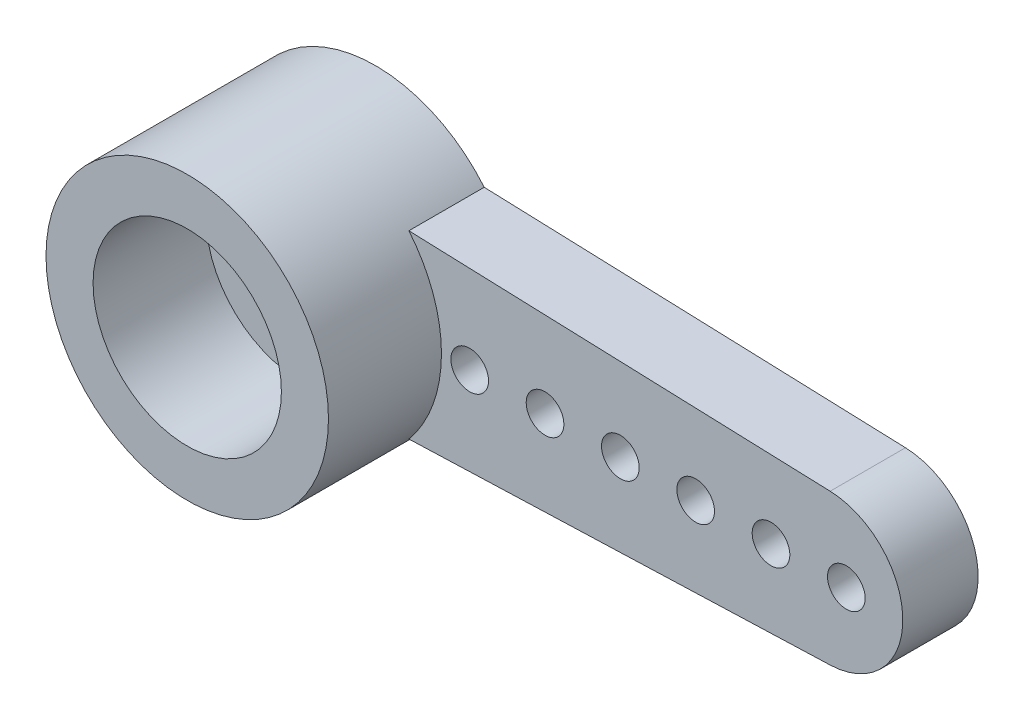
from build123d import *

# Parameters (mm, degrees)
EXTRUDE_3_DEPTH     = 2
EXTRUDE_3_2_DEPTH   = 2
SKETCH_2_R          = 3.75
SKETCH_2_R_2        = 2.5
EXTRUDE_5_DEPTH     = 3
SKETCH_4_R          = 0.5
CUT_EXTRUDE_1_DEPTH = 2
SKETCH_5_R          = 2.5
EXTRUDE_7_DEPTH     = 1
SKETCH_1_2_R        = 3.75
EXTRUDE_1_DEPTH     = 2


with BuildPart() as part:
    # Sketch 1 → Бобышка-Вытянуть3 (new body)
    with BuildSketch(Plane.XY):
        with BuildLine():
            Line((0, -2.497361401), (0.233236, -2.489096416))
            ThreePointArc((0.233236, -2.489096416), (2.5, 0), (0.233236, 2.489096416))
            Line((0.233236, 2.489096416), (0, 2.497361401))
            Line((0, 2.497361401), (-0.233236, 2.489096416))
            ThreePointArc((-0.233236, 2.489096416), (-2.5, 0), (-0.233236, -2.489096416))
            Line((-0.233236, -2.489096416), (0, -2.497361401))
        make_face()
    extrude(amount=EXTRUDE_3_DEPTH)



with BuildPart() as body_2:
    # Sketch 1 → Extrude 3 2 (new body)
    with BuildSketch(Plane.XY):
        with BuildLine():
            Line((14.07082784, 1.998745461), (2.88547071, 2.395111434))
            ThreePointArc((2.88547071, 2.395111434), (3.75, 0), (2.88547071, -2.395111434))
            Line((2.88547071, -2.395111434), (14.07082784, -1.998745461))
            ThreePointArc((14.07082784, -1.998745461), (16, 0), (14.07082784, 1.998745461))
        make_face()
    extrude(amount=EXTRUDE_3_2_DEPTH)

    # Эскиз4 → Вырез-Вытянуть1 (cut)
    with BuildSketch(Plane(origin=(0, 0, 0), x_dir=(-1, 0, 0), z_dir=(0, 0, -1))):
        with Locations((-14.5, 0)):
            Circle(SKETCH_4_R)
        with Locations((-4.5, 0)):
            Circle(SKETCH_4_R)
        with Locations((-6.5, 0)):
            Circle(SKETCH_4_R)
        with Locations((-8.5, 0)):
            Circle(SKETCH_4_R)
        with Locations((-10.5, 0)):
            Circle(SKETCH_4_R)
        with Locations((-12.5, 0)):
            Circle(SKETCH_4_R)
    extrude(amount=-CUT_EXTRUDE_1_DEPTH, mode=Mode.SUBTRACT)


with BuildPart() as body_3:
    # Эскиз2 → Бобышка-Вытянуть5 (new body)
    with BuildSketch(Plane.XY.offset(2)):
        Circle(SKETCH_2_R)
        Circle(SKETCH_2_R_2, mode=Mode.SUBTRACT)
    extrude(amount=EXTRUDE_5_DEPTH)


with BuildPart() as body_4:
    # Эскиз5 → Бобышка-Вытянуть7 (new body)
    with BuildSketch(Plane(origin=(0, 0, 0), x_dir=(-1, 0, 0), z_dir=(0, 0, -1))):
        Circle(SKETCH_5_R)
    extrude(amount=-EXTRUDE_7_DEPTH)


with BuildPart() as part_1:
    add(part.part)

    add(body_2.part)  # 凸台-拉伸1 merges body 2

    add(body_3.part)  # 凸台-拉伸1 merges body 3

    add(body_4.part)  # 凸台-拉伸1 merges body 4
    # Sketch 1 2 → 凸台-拉伸1 (add)
    with BuildSketch(Plane(origin=(0, 0, 2), x_dir=(-1, 0, 0), z_dir=(0, 0, -1))):
        with Locations(Location((0, 0, 0), (0, 0, 180))):
            Circle(SKETCH_1_2_R)
    extrude(amount=EXTRUDE_1_DEPTH)


solid = part_1.part
